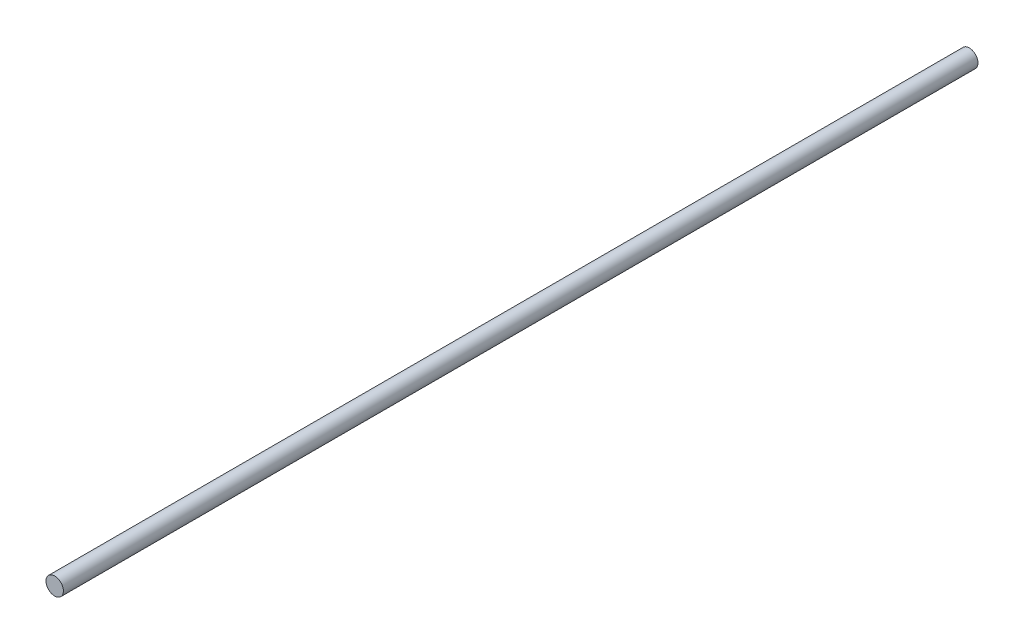
from build123d import *

# Parameters (mm, degrees)
SKETCH1_R           = 1
BOSS_EXTRUDE1_DEPTH = 105


with BuildPart() as part:
    # Sketch1 → Boss-Extrude1 (new body)
    with BuildSketch(Plane.XY):
        with Locations((20, 0)):
            Circle(SKETCH1_R)
    extrude(amount=-BOSS_EXTRUDE1_DEPTH)


solid = part.part
